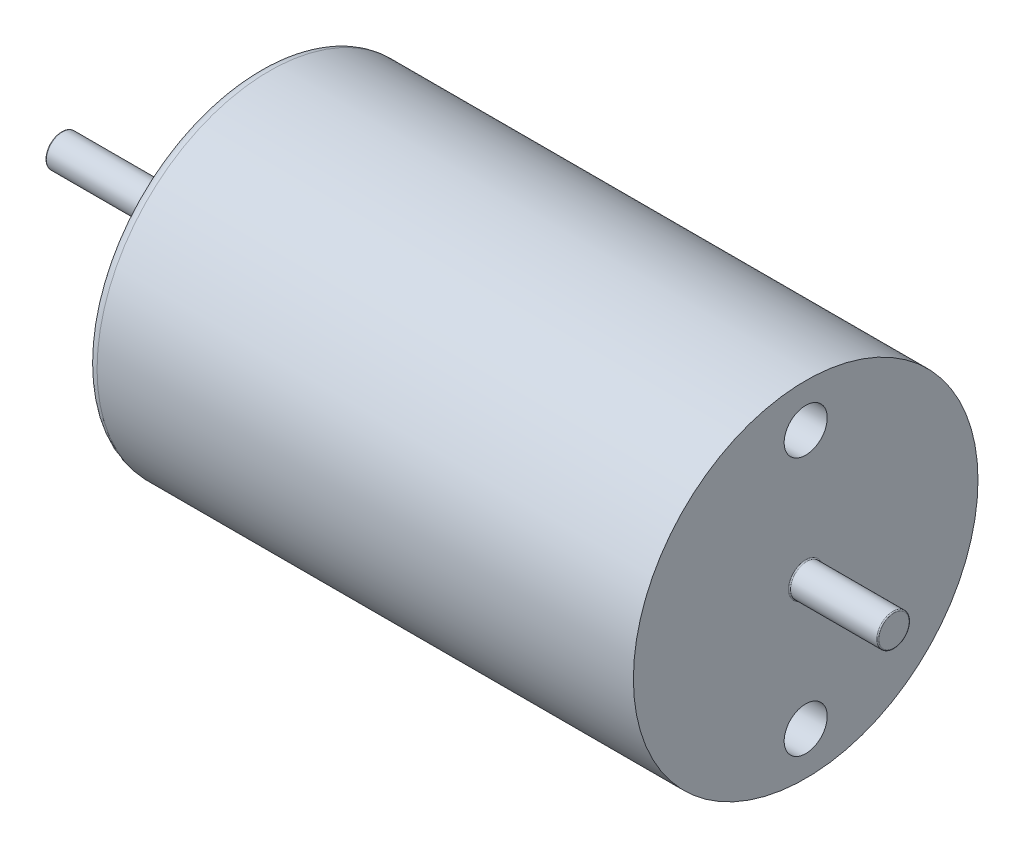
from build123d import *

# Parameters (mm, degrees)
SKETCH2_R          = 1
CUT_EXTRUDE2_DEPTH = 3
CIRPATTERN1_COUNT  = 6
FILLET2_R          = 0.5
FILLET3_R          = 0.05
SKETCH3_R          = 1
CUT_EXTRUDE3_DEPTH = 3
CIRPATTERN2_COUNT  = 2


with BuildPart() as part:
    # Sketch1 → Revolve1 (revolve)
    with BuildSketch(Plane(origin=(0, 0, 0), x_dir=(1, 0, 0), z_dir=(0, 1, 0))):
        Polygon((0, 0), (-38.65, 0), (-38.65, 0.75), (-32.3, 0.75), (-32.3, 2.5), (-29.5, 2.5), (-29.5, 8), (-4.1, 8), (-4.1, 0.75), (0, 0.75), align=None)
    revolve(axis=Axis((0, 0, 0), (-1, 0, 0)))

    # Sketch2 → Cut-Extrude2 (cut)
    with BuildSketch(Plane.ZY.offset(29.5)):
        with Locations((0, 5)):
            Circle(SKETCH2_R)
    cut_extrude2 = extrude(amount=-CUT_EXTRUDE2_DEPTH, mode=Mode.SUBTRACT)

    # CirPattern1: Cut-Extrude2 ×6 about axis
    cirpattern1_axis = Axis((0, 0, 0), (1, 0, 0))
    for i in range(1, CIRPATTERN1_COUNT):
        add(cut_extrude2.rotate(cirpattern1_axis, i * 360 / CIRPATTERN1_COUNT), mode=Mode.SUBTRACT)

    # Fillet2
    fillet2_edges = [part.edges().sort_by_distance(p)[0] for p in [
        (-29.5, 0, 8),
    ]]
    fillet(fillet2_edges, radius=FILLET2_R)

    # Fillet3
    fillet3_edges = [part.edges().sort_by_distance(p)[0] for p in [
        (-32.3, 0, 2.5),
        (-32.3, 0, 0.75),
        (-38.65, 0, 0.75),
        (0, 0, 0.75),
        (-4.1, 0, 0.75),
        (-29.5, 0, 2.5),
    ]]
    fillet(fillet3_edges, radius=FILLET3_R)

    # Sketch3 → Cut-Extrude3 (cut)
    with BuildSketch(Plane(origin=(-4.1, 0, 0), x_dir=(0, 0, -1), z_dir=(1, 0, 0))):
        with Locations((0, 6)):
            Circle(SKETCH3_R)
    cut_extrude3 = extrude(amount=-CUT_EXTRUDE3_DEPTH, mode=Mode.SUBTRACT)

    # CirPattern2: Cut-Extrude3 ×2 about axis
    cirpattern2_axis = Axis((0, 0, 0), (1, 0, 0))
    for i in range(1, CIRPATTERN2_COUNT):
        add(cut_extrude3.rotate(cirpattern2_axis, i * 360 / CIRPATTERN2_COUNT), mode=Mode.SUBTRACT)


solid = part.part
